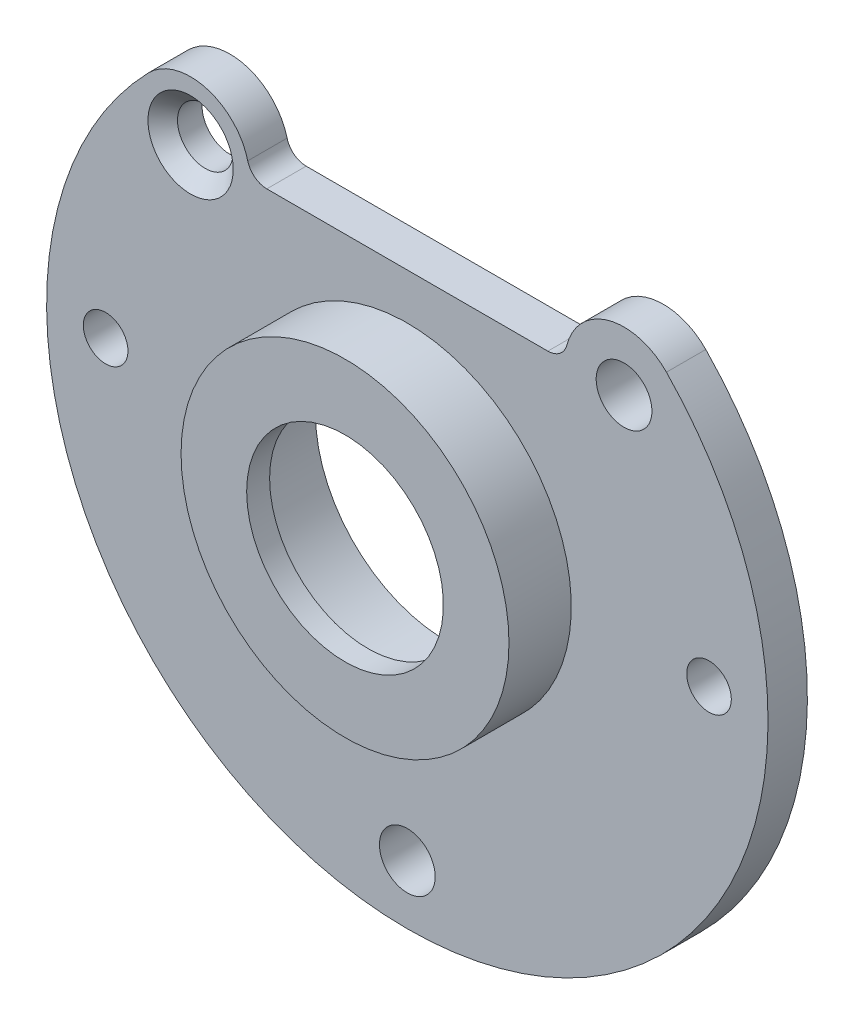
from build123d import *

# Parameters (mm, degrees)
EXTRUDE_1_DEPTH     = 6
SKETCH_2_R          = 25
EXTRUDE_2_DEPTH     = 9.5
SKETCH_3_R          = 20
CUT_EXTRUDE_1_DEPTH = 12
SKETCH_4_R          = 15
CUT_EXTRUDE_2_DEPTH = 79.70196948
HOLE_WIZARD_1_D     = 8.5
HOLE_WIZARD_1_DEPTH = 93.98
HOLE_WIZARD_M8_1_D  = 6.8


with BuildPart() as part:
    # 草图1 → 凸台-拉伸1 (new body)
    with BuildSketch(Plane.XY):
        with BuildLine():
            Line((21.426473245, 32), (-21.426473245, 32))
            ThreePointArc((-21.426473245, 32), (-23.263590552, 32.628291755), (-24.331210755, 34.25))
            ThreePointArc((-24.331210755, 34.25), (-30.746282552, 40.701376437), (-39.510832187, 38.260869565))
            ThreePointArc((-39.510832187, 38.260869565), (0, -55), (39.510832187, 38.260869565))
            ThreePointArc((39.510832187, 38.260869565), (30.746282552, 40.701376437), (24.331210755, 34.25))
            ThreePointArc((24.331210755, 34.25), (23.263590552, 32.628291755), (21.426473245, 32))
        make_face()
    extrude(amount=EXTRUDE_1_DEPTH)

    # 草图2 → 凸台-拉伸2 (add)
    with BuildSketch(Plane.XY.offset(6)):
        with Locations(Location((0, 0, 0), (0, 0, 180))):
            Circle(SKETCH_2_R)
    extrude(amount=EXTRUDE_2_DEPTH)

    # 草图3 → 切除-拉伸1 (cut)
    with BuildSketch(Plane(origin=(0, 0, 0), x_dir=(-1, 0, 0), z_dir=(0, 0, -1))):
        Circle(SKETCH_3_R)
    extrude(amount=-CUT_EXTRUDE_1_DEPTH, mode=Mode.SUBTRACT)

    # 草图4 → 切除-拉伸2 (cut, through all)
    with BuildSketch(Plane(origin=(0, 0, 12), x_dir=(-1, 0, 0), z_dir=(0, 0, -1))):
        Circle(SKETCH_4_R)
    extrude(amount=-CUT_EXTRUDE_2_DEPTH, mode=Mode.SUBTRACT)

    # 孔1
    with Locations(Plane.XY.offset(6)):
        with Locations((33.045423284, 32), (0, -46)):
            Hole(HOLE_WIZARD_1_D / 2, depth=HOLE_WIZARD_1_DEPTH)

    # M8 螺纹孔1 (through all)
    with Locations(Plane.XY.offset(6)):
        with Locations((46, 0), (-46, 0)):
            Hole(HOLE_WIZARD_M8_1_D / 2)

    # 草图11 → Ø8.5 (8.5) 直径孔1 (revolve, cut)
    with BuildSketch(Plane(origin=(-33.045423284, 32, 6), x_dir=(0, -1, 0), z_dir=(1, 0, 0))):
        Polygon((0, 0), (0, 6), (4.25, 6), (4.25, 2.25), (6.5, 0), align=None)
    revolve(axis=Axis((-33.045423284, 32, 12.35), (0, 0, -1)), mode=Mode.SUBTRACT)


solid = part.part
